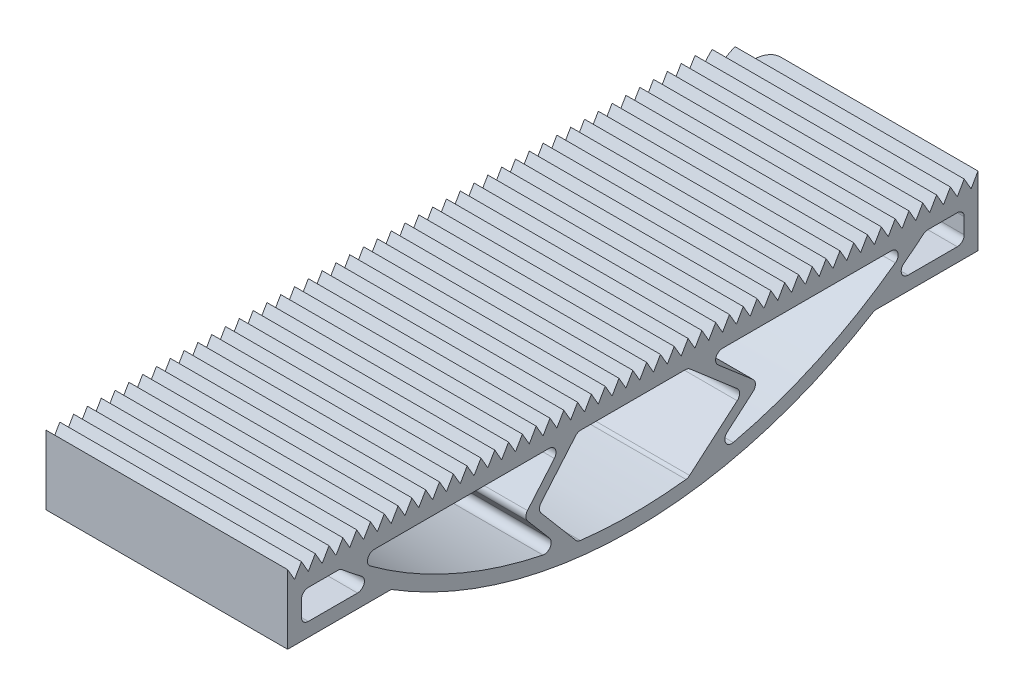
from build123d import *

# Parameters (mm, degrees)
SKETCH1_W           = 35
SKETCH1_H           = 100
BOSS_EXTRUDE1_DEPTH = 10
CUT_EXTRUDE1_DEPTH  = 107.418983269
LPATTERN1_COUNT     = 50
LPATTERN1_PITCH     = 2
BOSS_EXTRUDE2_DEPTH = 35
FILLET1_R           = 6.5
SKETCH5_W           = 5.628511334
SKETCH5_H           = 4.267949192
CUT_EXTRUDE2_DEPTH  = 107.418983269
FILLET2_R           = 1


with BuildPart() as part:
    # Sketch1 → Boss-Extrude1 (new body)
    with BuildSketch(Plane(origin=(0, 0, 0), x_dir=(1, 0, 0), z_dir=(0, 1, 0))):
        with Locations((17.5, 50)):
            Rectangle(SKETCH1_W, SKETCH1_H)
    extrude(amount=BOSS_EXTRUDE1_DEPTH)

    # Sketch3 → Cut-Extrude1 (cut, through all)
    with BuildSketch(Plane.ZY):
        Polygon((-100, 10), (-99, 8.267949192), (-98, 10), align=None)
    cut_extrude1 = extrude(amount=-CUT_EXTRUDE1_DEPTH, mode=Mode.SUBTRACT)

    # LPattern1: Cut-Extrude1 ×50
    with Locations(*[(0, 0, i * LPATTERN1_PITCH) for i in range(1, LPATTERN1_COUNT)]):
        add(cut_extrude1, mode=Mode.SUBTRACT)

    # Sketch4 → Boss-Extrude2 (add)
    with BuildSketch(Plane(origin=(35, 0, 0), x_dir=(0, 0, -1), z_dir=(1, 0, 0))):
        with BuildLine():
            Line((15, 0), (85, 0))
            ThreePointArc((85, 0), (50, -10), (15, 0))
        make_face()
    extrude(amount=-BOSS_EXTRUDE2_DEPTH)

    # Fillet1
    fillet1_edges = [part.edges().sort_by_distance(p)[0] for p in [
        (0, 5, -100),
    ]]
    fillet(fillet1_edges, radius=FILLET1_R)

    # Sketch5 → Cut-Extrude2 (cut, through all)
    with BuildSketch(Plane.ZY):
        with Locations((-95.185744333, 4.133974596)):
            Rectangle(SKETCH5_W, SKETCH5_H)
        with BuildLine():
            ThreePointArc((-92.371488666, 6.267949192), (-89.617737689, 4.058206439), (-86.748958552, 2))
            Line((-86.748958552, 2), (-92.371488666, 2))
            Line((-92.371488666, 2), (-92.371488666, 6.267949192))
        make_face()
        with BuildLine():
            Line((-60.299711515, 6.267949192), (-90.371488666, 6.267949192))
            ThreePointArc((-90.371488666, 6.267949192), (-76.431686672, -2.311322045), (-60.776399584, -7.08981143))
            Line((-60.776399584, -7.08981143), (-68.299711515, -0.616025404))
            Line((-68.299711515, -0.616025404), (-60.299711515, 6.267949192))
        make_face()
        with BuildLine():
            Line((-42, 6.267949192), (-58, 6.267949192))
            Line((-58, 6.267949192), (-66, -0.616025404))
            Line((-66, -0.616025404), (-58, -7.5))
            ThreePointArc((-58, -7.5), (-50, -8), (-42, -7.5))
            Line((-42, -7.5), (-36.160154055, -0.616025404))
            Line((-36.160154055, -0.616025404), (-42, 6.267949192))
        make_face()
        with BuildLine():
            Line((-9.628511334, 6.267949192), (-40.032965827, 6.267949192))
            Line((-40.032965827, 6.267949192), (-34.193119883, -0.616025404))
            Line((-34.193119883, -0.616025404), (-39.760500511, -7.178819556))
            ThreePointArc((-39.760500511, -7.178819556), (-23.816571501, -2.422741303), (-9.628511334, 6.267949192))
        make_face()
        with Locations((-4.814255667, 4.133974596)):
            Rectangle(SKETCH5_W, SKETCH5_H)
        with BuildLine():
            Line((-7.628511334, 6.267949192), (-7.628511334, 2))
            Line((-7.628511334, 2), (-13.251041448, 2))
            ThreePointArc((-13.251041448, 2), (-10.382262311, 4.058206439), (-7.628511334, 6.267949192))
        make_face()
    extrude(amount=-CUT_EXTRUDE2_DEPTH, mode=Mode.SUBTRACT)

    # Fillet2
    fillet2_edges = [part.edges().sort_by_distance(p)[0] for p in [
        (17.5, -7.5, -58),
        (17.5, -0.616025404, -66),
        (17.5, 6.267949192, -58),
        (17.5, 6.267949192, -42),
        (17.5, -0.616025404, -36.160154055),
        (17.5, -7.5, -42),
        (17.5, 6.267949192, -90.371488666),
        (17.5, 6.267949192, -60.299711515),
        (17.5, -0.616025404, -68.299711515),
        (17.5, -7.08981143, -60.776399584),
        (17.5, 6.267949192, -7.628511334),
        (17.5, 6.267949192, -2),
        (17.5, 2, -2),
        (17.5, 2, -13.251041448),
        (17.5, -7.178819556, -39.760500511),
        (17.5, -0.616025404, -34.193119883),
        (17.5, 6.267949192, -40.032965827),
        (17.5, 6.267949192, -9.628511334),
        (17.5, 2, -86.748958552),
        (18.40479212, 2, -98),
        (18.40479212, 6.267949192, -98),
        (17.5, 6.267949192, -92.371488666),
    ]]
    fillet(fillet2_edges, radius=FILLET2_R)


solid = part.part
